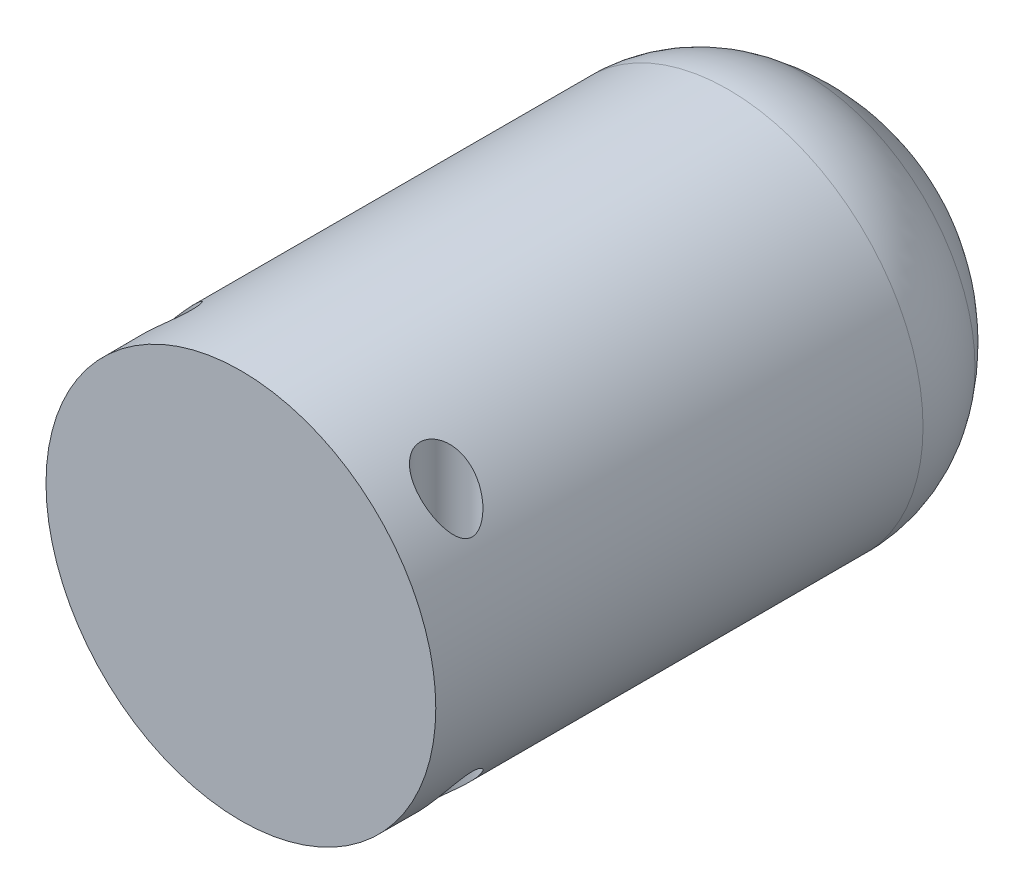
from build123d import *

# Parameters (mm, degrees)
SKETCH1_R               = 1.5
BOSS_EXTRUDE1_DEPTH     = 4
DOME1_FACE_RADIUS       = 1.5
DOME1_HEIGHT            = 1
FILLET1_R               = 1
CUT_EXTRUDE1_DEPTH      = 5.52769433
CUT_EXTRUDE1_DEPTH_BACK = 5.52769433
SKETCH3_R               = 0.2


with BuildPart() as part:
    # Sketch1 → Boss-Extrude1 (new body)
    with BuildSketch(Plane.XY):
        Circle(SKETCH1_R)
    extrude(amount=BOSS_EXTRUDE1_DEPTH)

    # Dome1: a dome of height H over a round flat face of radius A is a cap of a sphere of radius (A * A + H * H) / (2 * H)
    dome1_r = (DOME1_FACE_RADIUS * DOME1_FACE_RADIUS + DOME1_HEIGHT * DOME1_HEIGHT) / (2 * DOME1_HEIGHT)
    dome1_base = Plane((0, 0, 0), z_dir=(0, 0, -1))
    with Locations(dome1_base.offset(DOME1_HEIGHT - dome1_r)):
        dome1_ball = Sphere(dome1_r, mode=Mode.PRIVATE)
    add(split(dome1_ball, bisect_by=dome1_base, keep=Keep.TOP, mode=Mode.PRIVATE))

    # Fillet1
    fillet1_edges = [part.edges().sort_by_distance(p)[0] for p in [
        (0, 1.5, 0),
    ]]
    fillet(fillet1_edges, radius=FILLET1_R)

    # Sketch3 → Cut-Extrude1 (cut, two sides: drawn at the far end of the back side and taken through both)
    with BuildSketch(Plane(origin=(0, 0, 0), x_dir=(1, 0, 0), z_dir=(0, 1, 0)).offset(-CUT_EXTRUDE1_DEPTH_BACK)):
        with Locations(Location((1.08, -3.5, 0), (0, 0, 270))):
            Circle(SKETCH3_R)
        with Locations(Location((-1.08, -3.5, 0), (0, 0, 270))):
            Circle(SKETCH3_R)
    extrude(amount=CUT_EXTRUDE1_DEPTH + CUT_EXTRUDE1_DEPTH_BACK, mode=Mode.SUBTRACT)


solid = part.part
